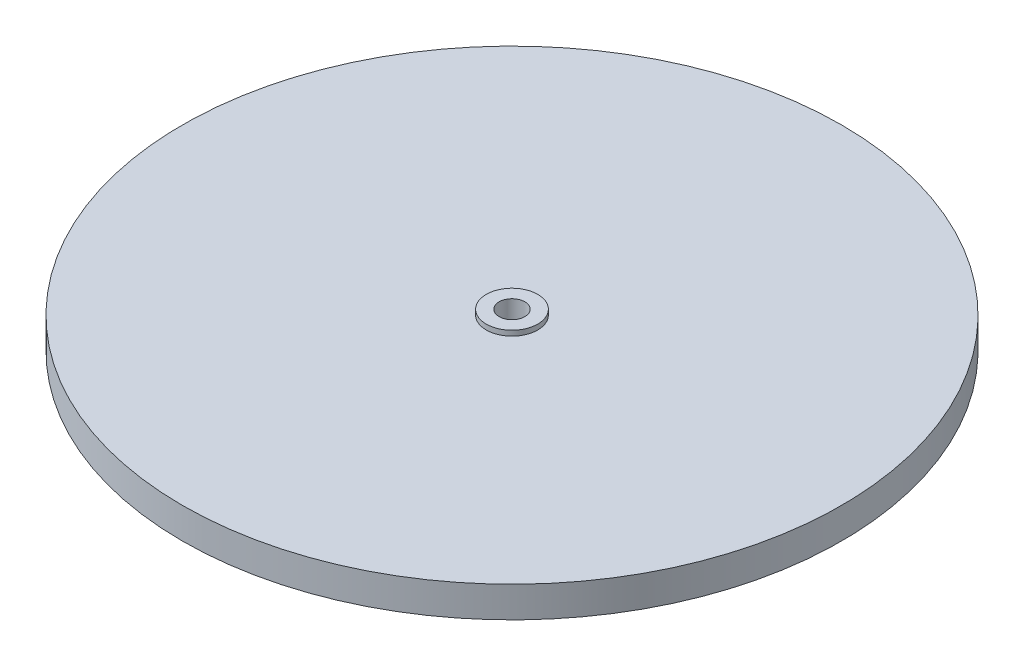
from build123d import *

# Parameters (mm, degrees)
EXTRUDE_1_DEPTH      = 3
EXTRUDE_1_DEPTH_BACK = 3
SKETCH_1_R           = 64
EXTRUDE_2_DEPTH      = 4
EXTRUDE_2_DEPTH_BACK = 7
SKETCH_2_R           = 5
SKETCH_3_R           = 2.5
CUT_EXTRUDE_1_DEPTH  = 92.175654645


with BuildPart() as part:
    # 草图1 → 凸台-拉伸1 (new, two sides: drawn at the far end of the back side and taken through both)
    with BuildSketch(Plane(origin=(0, 0, 0), x_dir=(1, 0, 0), z_dir=(0, 1, 0)).offset(-EXTRUDE_1_DEPTH_BACK)):
        Circle(SKETCH_1_R)
    extrude(amount=EXTRUDE_1_DEPTH + EXTRUDE_1_DEPTH_BACK)

    # 草图2 → 凸台-拉伸2 (add, two sides: drawn at the far end of the back side and taken through both)
    with BuildSketch(Plane(origin=(0, 0, 0), x_dir=(1, 0, 0), z_dir=(0, 1, 0)).offset(-EXTRUDE_2_DEPTH_BACK)):
        Circle(SKETCH_2_R)
    extrude(amount=EXTRUDE_2_DEPTH + EXTRUDE_2_DEPTH_BACK)

    # 草图3 → 切除-拉伸1 (cut, through all)
    with BuildSketch(Plane(origin=(0, 4, 0), x_dir=(1, 0, 0), z_dir=(0, 1, 0))):
        Circle(SKETCH_3_R)
    extrude(amount=-CUT_EXTRUDE_1_DEPTH, mode=Mode.SUBTRACT)


solid = part.part
